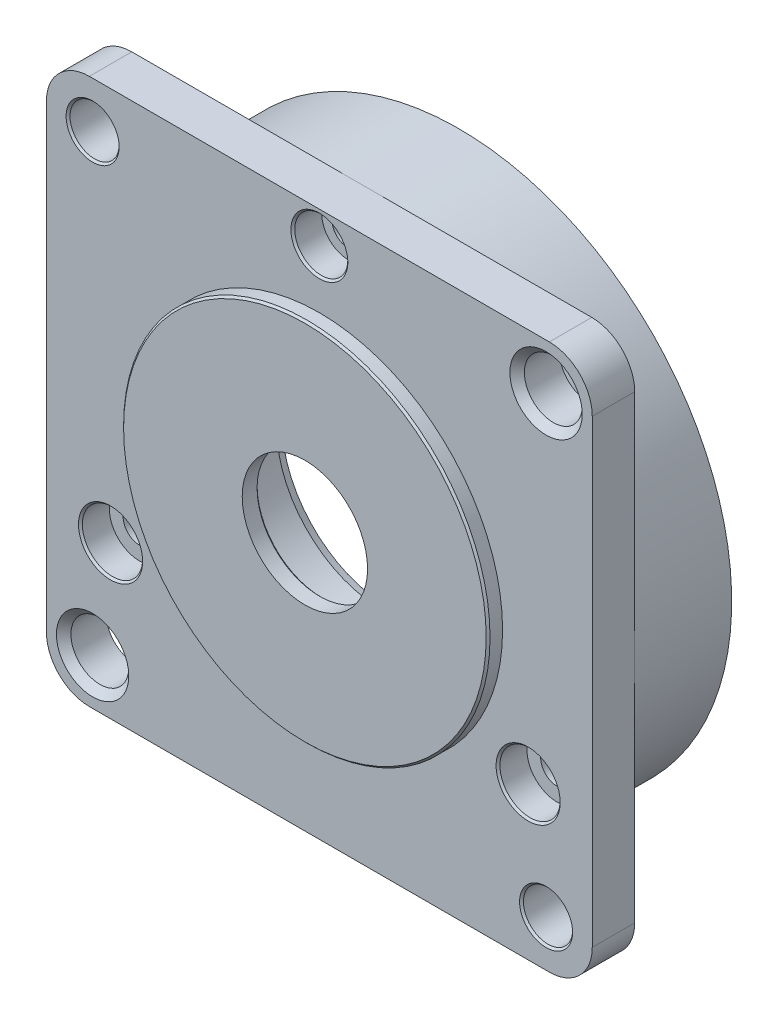
from build123d import *

# Parameters (mm, degrees)
IZIM1_R                     = 2.55
IZIM1_R_2                   = 3
IZIM1_R_3                   = 6.5
IZIM1_R_4                   = 1.7
Y_KSEKLIK_EKSTR_ZYON1_DEPTH = 4.4
IZIM2_R                     = 19
IZIM2_R_2                   = 6.5
Y_KSEKLIK_EKSTR_ZYON2_DEPTH = 1.5
PAH1_SIZE                   = 0.2
PAH2_SIZE                   = 0.75
KES_EKSTR_ZYON1_START       = -3
IZIM3_R                     = 3.125
IZIM3_R_2                   = 1.7
IZIM3_R_3                   = 2.75
KES_EKSTR_ZYON1_DEPTH       = 3
PAH3_SIZE                   = 0.2
IZIM4_R                     = 11
KES_EKSTR_ZYON2_DEPTH       = 3.66
IZIM5_R                     = 8.9
KES_EKSTR_ZYON3_DEPTH       = 0.5
PAH4_SIZE                   = 0.2
Y_KSEKLIK_EKSTR_ZYON3_START = 2.9
IZIM6_R                     = 12.75
IZIM6_R_2                   = 11
Y_KSEKLIK_EKSTR_ZYON3_DEPTH = 2.9
PAH5_SIZE                   = 0.2
PAH5_SIZE2                  = 0.746410162
IZIM7_R                     = 28.3
IZIM7_R_2                   = 26.75
Y_KSEKLIK_EKSTR_ZYON4_DEPTH = 10.06
KES_EKSTR_ZYON4_START       = -0.5
IZIM8_R                     = 12.75
KES_EKSTR_ZYON4_DEPTH       = 0.5
IZIM10_R                    = 27.5
KES_EKSTR_ZYON5_DEPTH       = 1.5


with BuildPart() as part:
    # Çizim1 → Yükseklik-Ekstrüzyon1 (new body)
    with BuildSketch(Plane.XY):
        with BuildLine():
            Line((-23.85, 28.3), (23.85, 28.3))
            ThreePointArc((23.85, 28.3), (26.996625176, 26.996625176), (28.3, 23.85))
            Line((28.3, 23.85), (28.3, -23.85))
            ThreePointArc((28.3, -23.85), (26.996625176, -26.996625176), (23.85, -28.3))
            Line((23.85, -28.3), (-23.85, -28.3))
            ThreePointArc((-23.85, -28.3), (-26.996625176, -26.996625176), (-28.3, -23.85))
            Line((-28.3, -23.85), (-28.3, 23.85))
            ThreePointArc((-28.3, 23.85), (-26.996625176, 26.996625176), (-23.85, 28.3))
        make_face()
        with Locations((-23.511300474, 23.511300474)):
            Circle(IZIM1_R, mode=Mode.SUBTRACT)
        with Locations((23.511300474, -23.511300474)):
            Circle(IZIM1_R, mode=Mode.SUBTRACT)
        with Locations((-23.511300474, -23.511300474)):
            Circle(IZIM1_R_2, mode=Mode.SUBTRACT)
        with Locations((23.511300474, 23.511300474)):
            Circle(IZIM1_R_2, mode=Mode.SUBTRACT)
        Circle(IZIM1_R_3, mode=Mode.SUBTRACT)
        with Locations((0, 25)):
            Circle(IZIM1_R_4, mode=Mode.SUBTRACT)
        with Locations((21.650635095, -12.5)):
            Circle(IZIM1_R_4, mode=Mode.SUBTRACT)
        with Locations((-21.650635095, -12.5)):
            Circle(IZIM1_R_4, mode=Mode.SUBTRACT)
    extrude(amount=Y_KSEKLIK_EKSTR_ZYON1_DEPTH)

    # Çizim2 → Yükseklik-Ekstrüzyon2 (add)
    with BuildSketch(Plane.XY.offset(4.4)):
        with Locations(Location((0, 0, 0), (0, 0, 180))):
            Circle(IZIM2_R)
        Circle(IZIM2_R_2, mode=Mode.SUBTRACT)
    extrude(amount=Y_KSEKLIK_EKSTR_ZYON2_DEPTH)

    # Pah1
    pah1_edges = [part.edges().sort_by_distance(p)[0] for p in [
        (19, 0, 5.9),
    ]]
    chamfer(pah1_edges, length=PAH1_SIZE)

    # Pah2
    pah2_edges = [part.edges().sort_by_distance(p)[0] for p in [
        (20.511300474, 23.511300474, 4.4),
        (-26.511300474, -23.511300474, 4.4),
    ]]
    chamfer(pah2_edges, length=PAH2_SIZE)

    # Çizim3 → Kes-Ekstrüzyon1 (cut)
    # profile 1 of 3: a face of its own
    with BuildSketch(Plane.XY.offset(4.4).offset(KES_EKSTR_ZYON1_START)):
        with Locations((-21.650635095, -12.5)):
            Circle(IZIM3_R)
        with Locations((-21.650635095, -12.5)):
            Circle(IZIM3_R_2, mode=Mode.SUBTRACT)
    # profile 2 of 3: a face of its own
    with BuildSketch(Plane.XY.offset(4.4).offset(KES_EKSTR_ZYON1_START)):
        with Locations((21.650635095, -12.5)):
            Circle(IZIM3_R)
        with Locations((21.650635095, -12.5)):
            Circle(IZIM3_R_2, mode=Mode.SUBTRACT)
    # profile 3 of 3: a face of its own
    with BuildSketch(Plane.XY.offset(4.4).offset(KES_EKSTR_ZYON1_START)):
        with Locations((0, 25)):
            Circle(IZIM3_R_3)
        with Locations((0, 25)):
            Circle(IZIM3_R_2, mode=Mode.SUBTRACT)
    extrude(amount=KES_EKSTR_ZYON1_DEPTH, mode=Mode.SUBTRACT)

    # Pah3
    pah3_edges = [part.edges().sort_by_distance(p)[0] for p in [
        (-26.061300474, 23.511300474, 4.4),
        (20.961300474, -23.511300474, 4.4),
        (-24.775635095, -12.5, 4.4),
        (18.525635095, -12.5, 4.4),
        (-2.75, 25, 4.4),
    ]]
    chamfer(pah3_edges, length=PAH3_SIZE)

    # Çizim4 → Kes-Ekstrüzyon2 (cut)
    with BuildSketch(Plane(origin=(0, 0, 0), x_dir=(-1, 0, 0), z_dir=(0, 0, -1))):
        Circle(IZIM4_R)
    extrude(amount=-KES_EKSTR_ZYON2_DEPTH, mode=Mode.SUBTRACT)

    # Çizim5 → Kes-Ekstrüzyon3 (cut)
    with BuildSketch(Plane(origin=(0, 0, 3.66), x_dir=(-1, 0, 0), z_dir=(0, 0, -1))):
        Circle(IZIM5_R)
    extrude(amount=-KES_EKSTR_ZYON3_DEPTH, mode=Mode.SUBTRACT)

    # Pah4
    pah4_edges = [part.edges().sort_by_distance(p)[0] for p in [
        (-6.5, 0, 4.16),
    ]]
    chamfer(pah4_edges, length=PAH4_SIZE)

    # Çizim6 → Yükseklik-Ekstrüzyon3 (add)
    with BuildSketch(Plane(origin=(0, 0, 0), x_dir=(-1, 0, 0), z_dir=(0, 0, -1)).offset(Y_KSEKLIK_EKSTR_ZYON3_START)):
        Circle(IZIM6_R)
        Circle(IZIM6_R_2, mode=Mode.SUBTRACT)
    extrude(amount=-Y_KSEKLIK_EKSTR_ZYON3_DEPTH)

    # Pah5
    pah5_edges = [part.edges().sort_by_distance(p)[0] for p in [
        (11, 0, -2.9),
    ]]
    pah5_side = [part.faces().sort_by_distance(p)[0] for p in [
        (12.389375542, 0, -2.9),
    ]]
    chamfer(pah5_edges, length=PAH5_SIZE, length2=PAH5_SIZE2, reference=pah5_side[0])

    # Çizim7 → Yükseklik-Ekstrüzyon4 (add)
    with BuildSketch(Plane(origin=(0, 0, 0), x_dir=(-1, 0, 0), z_dir=(0, 0, -1))):
        Circle(IZIM7_R)
        Circle(IZIM7_R_2, mode=Mode.SUBTRACT)
    extrude(amount=Y_KSEKLIK_EKSTR_ZYON4_DEPTH)

    # Çizim8 → Kes-Ekstrüzyon4 (cut)
    with BuildSketch(Plane(origin=(0, 0, 0), x_dir=(-1, 0, 0), z_dir=(0, 0, -1)).offset(KES_EKSTR_ZYON4_START)):
        with BuildLine():
            Line((-2.9, 25), (-2.9, 26.592339122))
            ThreePointArc((-2.9, 26.592339122), (-23.166179551, 13.375), (-24.479641226, -10.78469589))
            Line((-24.479641226, -10.78469589), (-23.100635095, -9.988526329))
            ThreePointArc((-23.100635095, -9.988526329), (-19.139161424, -11.05), (-20.200635095, -15.011473671))
            Line((-20.200635095, -15.011473671), (-21.579641226, -15.807643232))
            ThreePointArc((-21.579641226, -15.807643232), (0, -26.75), (21.579641226, -15.807643232))
            Line((21.579641226, -15.807643232), (20.200635095, -15.011473671))
            ThreePointArc((20.200635095, -15.011473671), (19.139161424, -11.05), (23.100635095, -9.988526329))
            Line((23.100635095, -9.988526329), (24.479641226, -10.78469589))
            ThreePointArc((24.479641226, -10.78469589), (23.166179551, 13.375), (2.9, 26.592339122))
            Line((2.9, 26.592339122), (2.9, 25))
            ThreePointArc((2.9, 25), (0, 22.1), (-2.9, 25))
        make_face()
        Circle(IZIM8_R, mode=Mode.SUBTRACT)
    extrude(amount=KES_EKSTR_ZYON4_DEPTH, mode=Mode.SUBTRACT)

    # Çizim10 → Kes-Ekstrüzyon5 (cut)
    with BuildSketch(Plane(origin=(0, 0, -10.06), x_dir=(-1, 0, 0), z_dir=(0, 0, -1))):
        Circle(IZIM10_R)
    extrude(amount=-KES_EKSTR_ZYON5_DEPTH, mode=Mode.SUBTRACT)


solid = part.part
